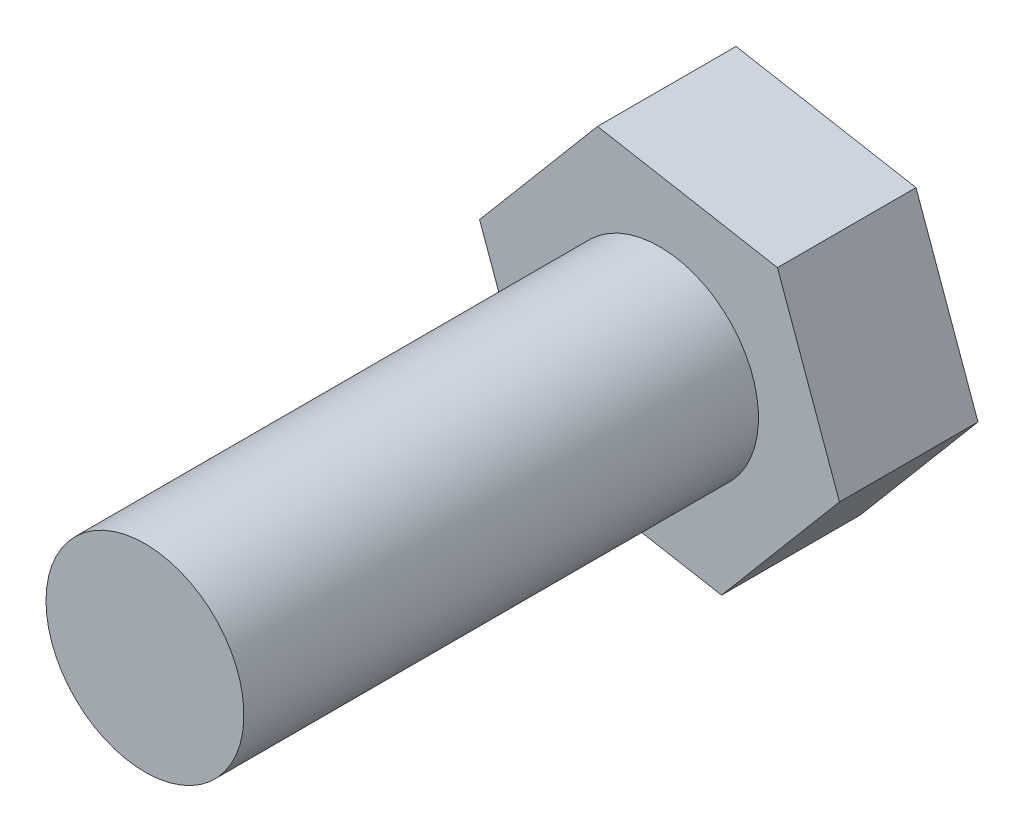
from build123d import *

# Parameters (mm, degrees)
EXTRUDE_1_DEPTH = 3.5
SKETCH_2_R      = 2.5
EXTRUDE_2_DEPTH = 13


with BuildPart() as part:
    # ｽｹｯﾁ1 → ﾎﾞｽ - 押し出し1 (new body)
    with BuildSketch(Plane.XY):
        Polygon((-2.979795067, -3.529044445), (1.566344606, -4.345100448), (4.546139674, -0.816056004), (2.979795067, 3.529044445), (-1.566344606, 4.345100448), (-4.546139674, 0.816056004), align=None)
    extrude(amount=EXTRUDE_1_DEPTH)

    # ｽｹｯﾁ2 → ﾎﾞｽ - 押し出し2 (add)
    with BuildSketch(Plane.XY.offset(3.5)):
        with Locations(Location((0, 0, 0), (0, 0, 180))):
            Circle(SKETCH_2_R)
    extrude(amount=EXTRUDE_2_DEPTH)


solid = part.part
